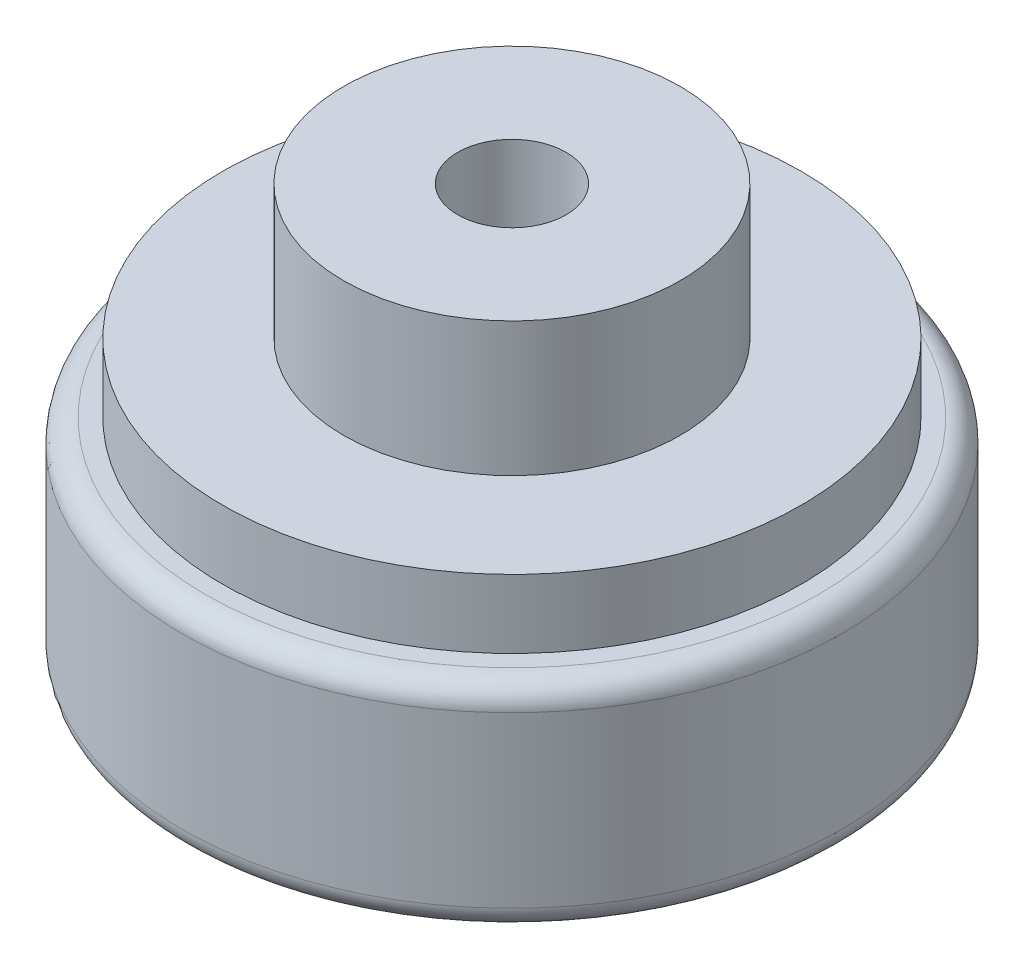
from build123d import *


with BuildPart() as part:
    # Sketch1 → Revolve1 (revolve)
    with BuildSketch(Plane.XY, mode=Mode.PRIVATE) as revolve1_sk:
        Polygon((18.7325, 22.5298), (6.0325, 22.5298), (6.0325, 0), (32.1945, 0), (32.1945, 7.62), (18.7325, 7.62), align=None)
        with BuildLine():
            Line((32.1945, 0), (6.0325, 0))
            Line((6.0325, 0), (6.0325, -23.9268))
            Line((6.0325, -23.9268), (34.1376, -23.9268))
            ThreePointArc((34.1376, -23.9268), (35.933651224, -23.182851224), (36.6776, -21.3868))
            Line((36.6776, -21.3868), (36.6776, -2.54))
            ThreePointArc((36.6776, -2.54), (35.933651224, -0.743948776), (34.1376, 0))
            Line((34.1376, 0), (32.1945, 0))
        make_face()
    revolve(revolve1_sk.sketch.rotate(Axis((0, 0, 0), (0, 1, 0)), 90), axis=Axis((0, 0, 0), (0, 1, 0)))


solid = part.part
